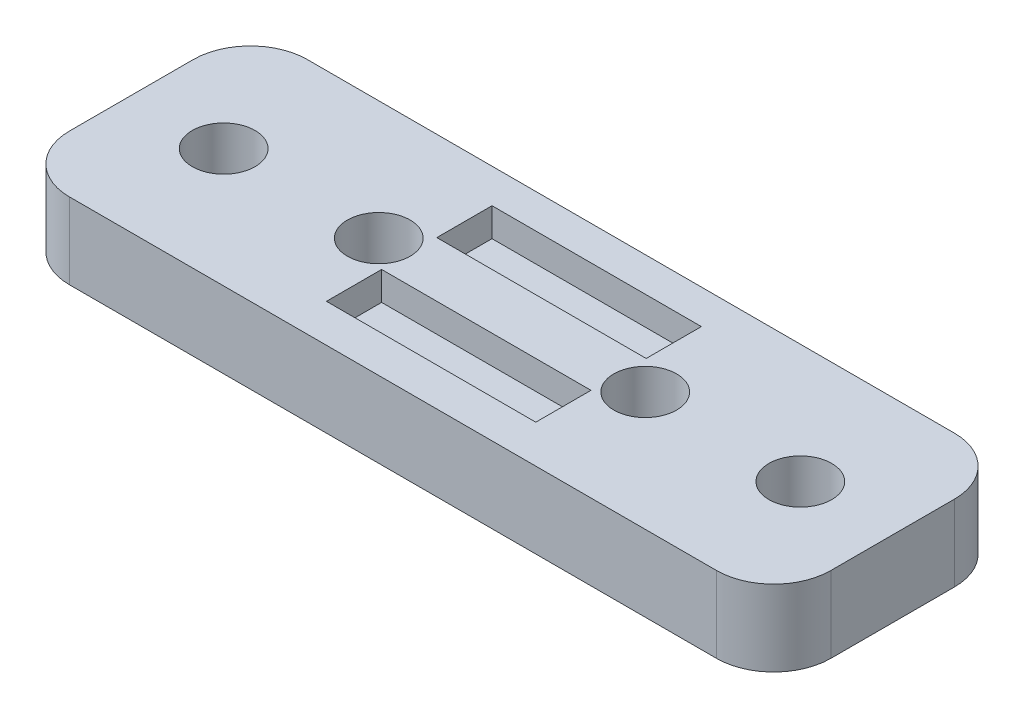
from build123d import *

# Parameters (mm, degrees)
SKETCH1_W           = 40
SKETCH1_H           = 12.5
BOSS_EXTRUDE1_DEPTH = 4
SKETCH2_R           = 1.65
CUT_EXTRUDE1_DEPTH  = 43.09809972
SKETCH3_W           = 11
SKETCH3_H           = 2.9
CUT_EXTRUDE2_DEPTH  = 1.5
FILLET1_R           = 3


with BuildPart() as part:
    # Sketch1 → Boss-Extrude1 (new body)
    with BuildSketch(Plane(origin=(0, 0, 0), x_dir=(1, 0, 0), z_dir=(0, 1, 0))):
        with Locations((20, -6.25)):
            Rectangle(SKETCH1_W, SKETCH1_H)
    extrude(amount=BOSS_EXTRUDE1_DEPTH)

    # Sketch2 → Cut-Extrude1 (cut, through all)
    with BuildSketch(Plane(origin=(0, 4, 0), x_dir=(1, 0, 0), z_dir=(0, 1, 0))):
        with Locations(Location((4.85, -6.25, 0), (0, 0, 270))):
            Circle(SKETCH2_R)
        with Locations(Location((13, -6.25, 0), (0, 0, 270))):
            Circle(SKETCH2_R)
        with Locations(Location((27, -6.25, 0), (0, 0, 270))):
            Circle(SKETCH2_R)
        with Locations(Location((35.15, -6.25, 0), (0, 0, 270))):
            Circle(SKETCH2_R)
    extrude(amount=-CUT_EXTRUDE1_DEPTH, mode=Mode.SUBTRACT)

    # Sketch3 → Cut-Extrude2 (cut)
    with BuildSketch(Plane(origin=(0, 4, 0), x_dir=(1, 0, 0), z_dir=(0, 1, 0))):
        with Locations((20, -3.25)):
            Rectangle(SKETCH3_W, SKETCH3_H)
        with Locations((20, -9.05)):
            Rectangle(SKETCH3_W, SKETCH3_H)
    extrude(amount=-CUT_EXTRUDE2_DEPTH, mode=Mode.SUBTRACT)

    # Fillet1
    fillet1_edges = [part.edges().sort_by_distance(p)[0] for p in [
        (0, 2, 0),
        (40, 2, 0),
        (40, 2, 12.5),
        (0, 2, 12.5),
    ]]
    fillet(fillet1_edges, radius=FILLET1_R)


solid = part.part
